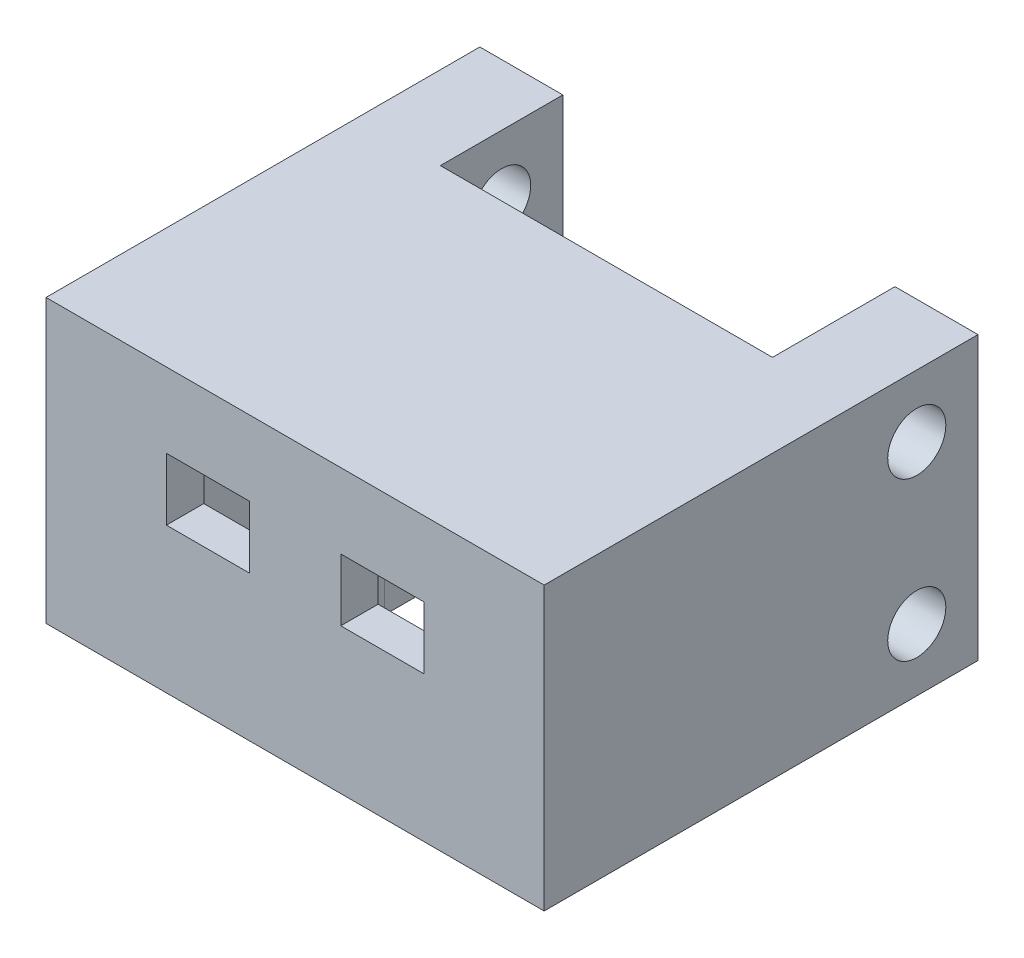
from build123d import *

# Parameters (mm, degrees)
EXTRUDE_1_DEPTH     = 1
EXTRUDE_2_DEPTH     = 4.8
SKETCH_4_W          = 2
SKETCH_4_H          = 5.8
EXTRUDE_3_DEPTH     = 10.45
SKETCH_5_W          = 2
SKETCH_5_H          = 2.95
EXTRUDE_4_DEPTH     = 1
SKETCH_6_W          = 2
SKETCH_6_H          = 1.5
CUT_EXTRUDE_1_DEPTH = 14.836274788
SKETCH_7_R          = 0.7
CUT_EXTRUDE_2_DEPTH = 16.122169157


with BuildPart() as part:
    # 草图1 → 凸台-拉伸1 (new body)
    with BuildSketch(Plane(origin=(0, 0, 0), x_dir=(1, 0, 0), z_dir=(0, 1, 0))):
        with BuildLine():
            Line((-4, 3.25), (-4, -4.25))
            Line((-4, -4.25), (4, -4.25))
            Line((4, -4.25), (4, 3.25))
            Line((4, 3.25), (2.1, 3.25))
            Line((2.1, 3.25), (2.1, 0))
            ThreePointArc((2.1, 0), (0, -2.1), (-2.1, 0))
            Line((-2.1, 0), (-2.1, 3.25))
            Line((-2.1, 3.25), (-4, 3.25))
        make_face()
    extrude(amount=EXTRUDE_1_DEPTH)

    # 草图3 → 凸台-拉伸2 (add)
    with BuildSketch(Plane(origin=(0, 1, 0), x_dir=(1, 0, 0), z_dir=(0, 1, 0))):
        Polygon((-3.3, 3.25), (-4, 3.25), (-4, -4.25), (4, -4.25), (4, 3.25), (3.3, 3.25), (3.3, -3.35), (-3.3, -3.35), align=None)
    extrude(amount=EXTRUDE_2_DEPTH)

    # 草图4 → 凸台-拉伸3 (add)
    with BuildSketch(Plane.XY.offset(4.25)):
        with Locations((5, 2.9)):
            Rectangle(SKETCH_4_W, SKETCH_4_H)
        with Locations((-5, 2.9)):
            Rectangle(SKETCH_4_W, SKETCH_4_H)
    extrude(amount=-EXTRUDE_3_DEPTH)

    # 草图5 → 凸台-拉伸4 (add)
    with BuildSketch(Plane(origin=(0, 5.8, 0), x_dir=(1, 0, 0), z_dir=(0, 1, 0))):
        Polygon((-6, 3.25), (-6, -4.25), (6, -4.25), (6, 3.25), (4, 3.25), (-4, 3.25), align=None)
        with Locations((-5, 4.725)):
            Rectangle(SKETCH_5_W, SKETCH_5_H)
        with Locations((5, 4.725)):
            Rectangle(SKETCH_5_W, SKETCH_5_H)
    extrude(amount=EXTRUDE_4_DEPTH)

    # 草图6 → 切除-拉伸1 (cut, through all)
    with BuildSketch(Plane.XY.offset(4.25)):
        with Locations((-2.1, 4.25)):
            Rectangle(SKETCH_6_W, SKETCH_6_H)
        with Locations((2.1, 4.25)):
            Rectangle(SKETCH_6_W, SKETCH_6_H)
    extrude(amount=-CUT_EXTRUDE_1_DEPTH, mode=Mode.SUBTRACT)

    # 草图7 → 切除-拉伸2 (cut, through all)
    with BuildSketch(Plane.ZY.offset(6)):
        with Locations(Location((-4.725, 5.3, 0), (0, 0, 270))):
            Circle(SKETCH_7_R)
        with Locations(Location((-4.725, 1.5, 0), (0, 0, 270))):
            Circle(SKETCH_7_R)
    extrude(amount=-CUT_EXTRUDE_2_DEPTH, mode=Mode.SUBTRACT)


solid = part.part
